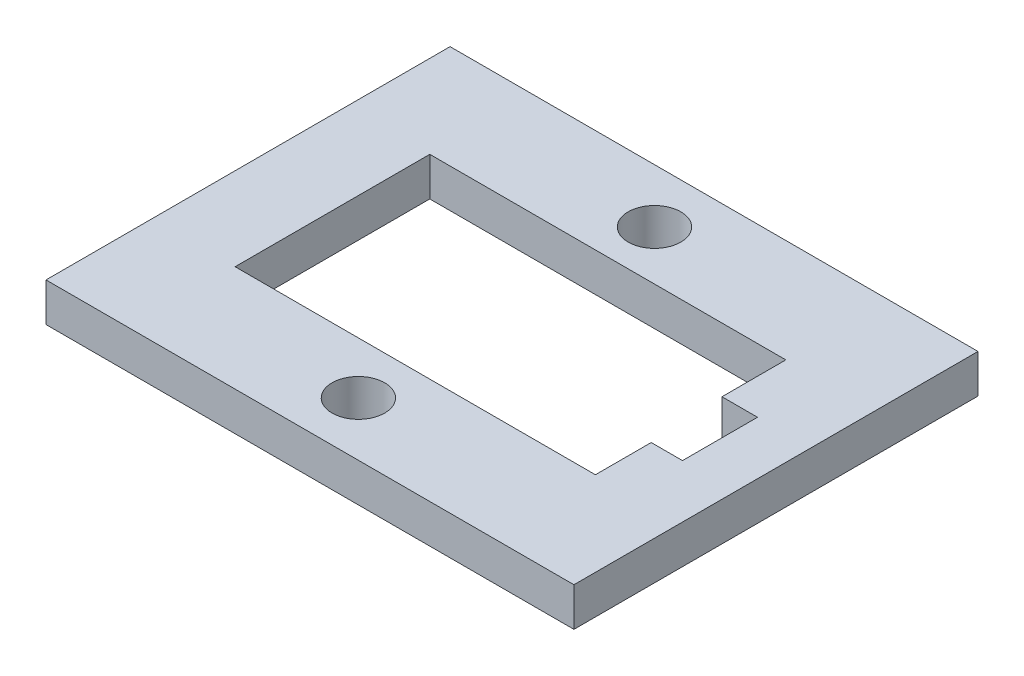
from build123d import *

# Parameters (mm, degrees)
SKETCH2_W           = 34.12443
SKETCH2_H           = 26.11773
SKETCH2_R           = 1.7
BOSS_EXTRUDE1_DEPTH = 1.25


with BuildPart() as part:
    # Sketch2 → Boss-Extrude1 (new, symmetric)
    with BuildSketch(Plane(origin=(0, 0, 0), x_dir=(1, 0, 0), z_dir=(0, 1, 0))):
        with Locations((0.360723362, 0.957713985)):
            Rectangle(SKETCH2_W, SKETCH2_H)
        with Locations(Location((0, 10.528858985, 0), (0, 0, 270))):
            Circle(SKETCH2_R, mode=Mode.SUBTRACT)
        with Locations(Location((0, -8.611151015, 0), (0, 0, 270))):
            Circle(SKETCH2_R, mode=Mode.SUBTRACT)
        Polygon((-11.329001638, 7.333548985), (11.685148827, 7.333548985), (11.685148827, 3.2058826), (13.982538362, 3.2058826), (13.982538362, -1.6439074), (11.960588362, -1.6439074), (11.960588362, -5.251141015), (-11.329001638, -5.251141015), align=None, mode=Mode.SUBTRACT)
    extrude(amount=BOSS_EXTRUDE1_DEPTH, both=True)


solid = part.part
